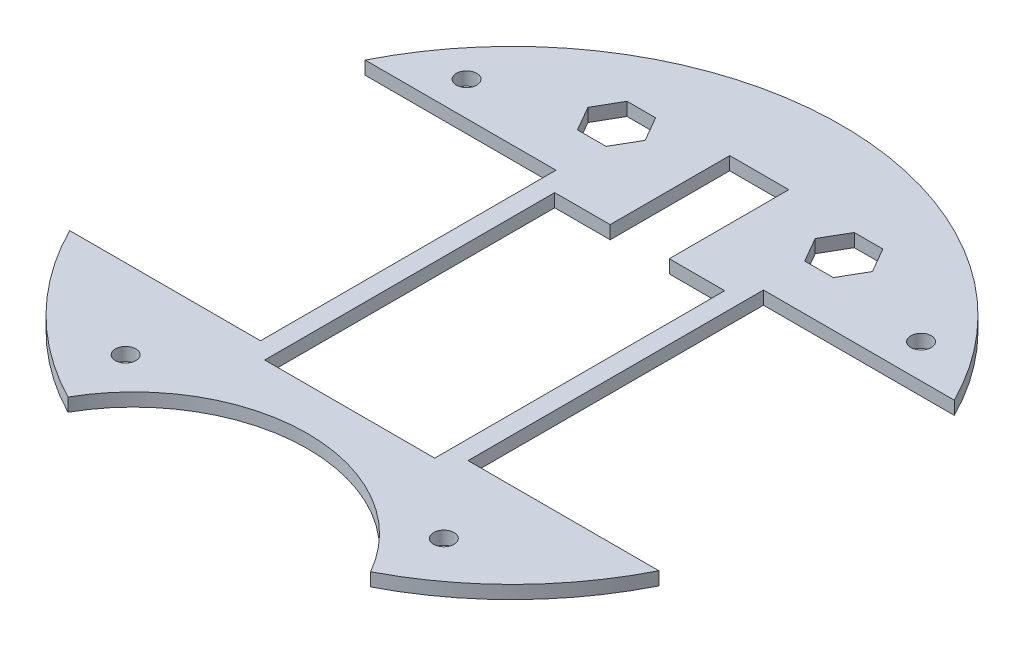
from build123d import *

# Parameters (mm, degrees)
BOSS_EXTRUDE1_DEPTH  = 2.9
SOLENOID_PLACEMENT_W = 37.4
SOLENOID_PLACEMENT_H = 63.8
CUT_EXTRUDE1_DEPTH   = 103.571487266
CUT_EXTRUDE3_DEPTH   = 103.571487266
SKETCH4_W            = 13
SKETCH4_H            = 26.3
CUT_EXTRUDE4_DEPTH   = 98.286484159
CUT_EXTRUDE5_DEPTH   = 98.286484159
SKETCH6_R            = 2.25
CUT_EXTRUDE6_DEPTH   = 98.286484159


with BuildPart() as part:
    # Sketch1 → Boss-Extrude1 (new body)
    with BuildSketch(Plane(origin=(0, 0, 0), x_dir=(1, 0, 0), z_dir=(0, 1, 0))):
        with BuildLine():
            ThreePointArc((33.29110537, -64.404598464), (0, 72.5), (-33.29110537, -64.404598464))
            ThreePointArc((-33.29110537, -64.404598464), (0, -44.989799638), (33.29110537, -64.404598464))
        make_face()
    extrude(amount=BOSS_EXTRUDE1_DEPTH)

    # solenoid placement → Cut-Extrude1 (cut, through all)
    with BuildSketch(Plane(origin=(0, 2.9, 0), x_dir=(1, 0, 0), z_dir=(0, 1, 0))):
        with Locations((0, -3.8)):
            Rectangle(SOLENOID_PLACEMENT_W, SOLENOID_PLACEMENT_H)
    extrude(amount=-CUT_EXTRUDE1_DEPTH, mode=Mode.SUBTRACT)

    # Sketch3 → Cut-Extrude3 (cut, through all)
    with BuildSketch(Plane(origin=(0, 2.9, 0), x_dir=(1, 0, 0), z_dir=(0, 1, 0))):
        with BuildLine():
            Line((-34.63, -32.5), (-22.83, -32.5))
            Line((-22.83, -32.5), (-22.83, 32.5))
            Line((-22.83, 32.5), (-64.807406984, 32.5))
            ThreePointArc((-64.807406984, 32.5), (-72.5, 0), (-64.807406984, -32.5))
            Line((-64.807406984, -32.5), (-34.63, -32.5))
        make_face()
        with BuildLine():
            Line((34.63, -32.5), (64.807406984, -32.5))
            ThreePointArc((64.807406984, -32.5), (72.5, 0), (64.807406984, 32.5))
            Line((64.807406984, 32.5), (22.83, 32.5))
            Line((22.83, 32.5), (22.83, -32.5))
            Line((22.83, -32.5), (34.63, -32.5))
        make_face()
    extrude(amount=-CUT_EXTRUDE3_DEPTH, mode=Mode.SUBTRACT)

    # Sketch4 → Cut-Extrude4 (cut, through all)
    with BuildSketch(Plane(origin=(0, 2.9, 0), x_dir=(1, 0, 0), z_dir=(0, 1, 0))):
        with Locations((0, 41.25)):
            Rectangle(SKETCH4_W, SKETCH4_H)
    extrude(amount=-CUT_EXTRUDE4_DEPTH, mode=Mode.SUBTRACT)

    # Sketch5 → Cut-Extrude5 (cut, through all)
    with BuildSketch(Plane(origin=(0, 2.9, 0), x_dir=(1, 0, 0), z_dir=(0, 1, 0))):
        Polygon((-18.706882066, 48), (-21.853441033, 53.45), (-28.146558967, 53.45), (-31.293117934, 48), (-28.146558967, 42.55), (-21.853441033, 42.55), align=None)
        Polygon((21.853441033, 42.55), (18.706882066, 48), (21.853441033, 53.45), (28.146558967, 53.45), (31.293117934, 48), (28.146558967, 42.55), align=None)
    extrude(amount=-CUT_EXTRUDE5_DEPTH, mode=Mode.SUBTRACT)

    # Sketch6 → Cut-Extrude6 (cut, through all)
    with BuildSketch(Plane(origin=(0, 2.9, 0), x_dir=(1, 0, 0), z_dir=(0, 1, 0))):
        with Locations(Location((35, -50, 0), (0, 0, 270))):
            Circle(SKETCH6_R)
        with Locations(Location((-35, -50, 0), (0, 0, 270))):
            Circle(SKETCH6_R)
        with Locations(Location((-50, 40, 0), (0, 0, 270))):
            Circle(SKETCH6_R)
        with Locations(Location((50, 40, 0), (0, 0, 270))):
            Circle(SKETCH6_R)
    extrude(amount=-CUT_EXTRUDE6_DEPTH, mode=Mode.SUBTRACT)


solid = part.part
